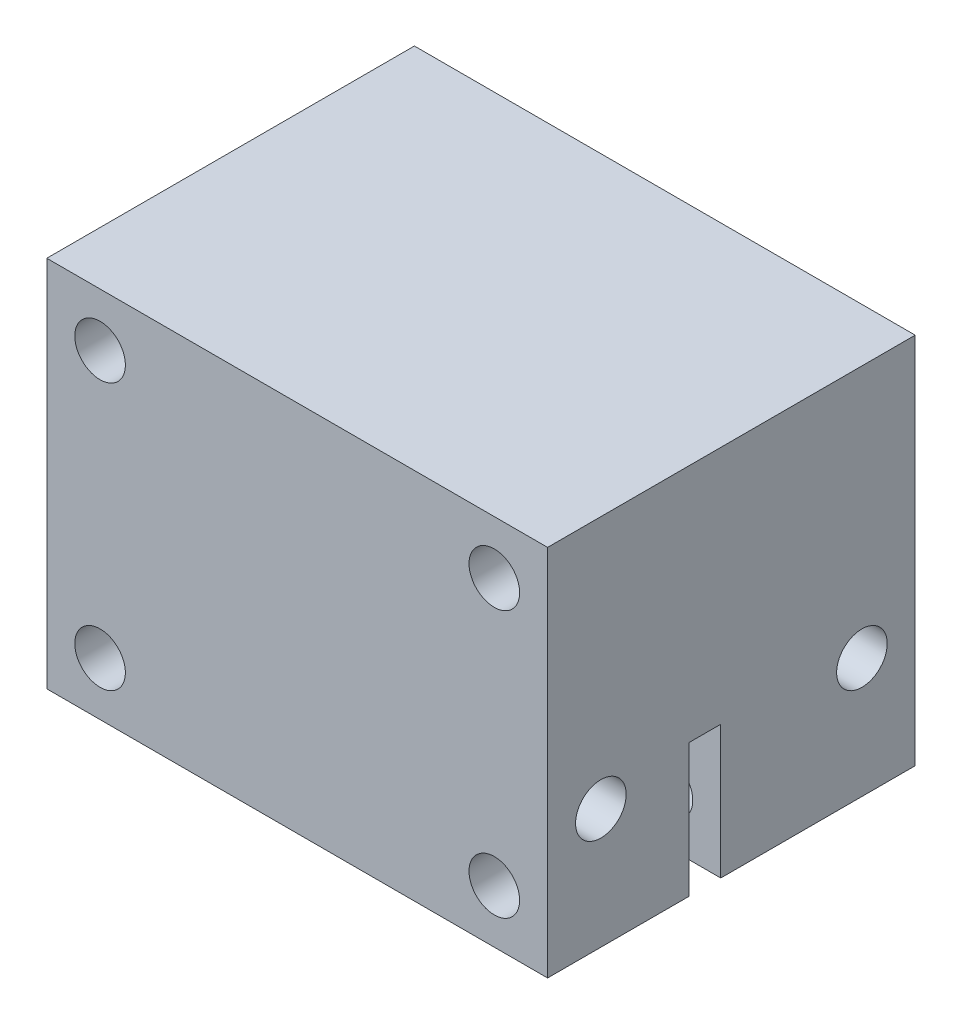
from build123d import *

# Parameters (mm, degrees)
SKETCH_1_W          = 37.6
SKETCH_1_H          = 28
SKETCH_1_R          = 1.9
EXTRUDE_1_DEPTH     = 27.6
SKETCH_2_R          = 1.9
SKETCH_2_W          = 2.4
SKETCH_2_H          = 10
CUT_EXTRUDE_1_DEPTH = 55.401470568


with BuildPart() as part:
    # 草图1 → 凸台-拉伸1 (new body)
    with BuildSketch(Plane.XY):
        with Locations((18.8, 14)):
            Rectangle(SKETCH_1_W, SKETCH_1_H)
        with Locations(Location((4, 24, 0), (0, 0, 180))):
            Circle(SKETCH_1_R, mode=Mode.SUBTRACT)
        with Locations(Location((33.6, 24, 0), (0, 0, 180))):
            Circle(SKETCH_1_R, mode=Mode.SUBTRACT)
        with Locations(Location((33.6, 4, 0), (0, 0, 180))):
            Circle(SKETCH_1_R, mode=Mode.SUBTRACT)
        with Locations(Location((4, 4, 0), (0, 0, 180))):
            Circle(SKETCH_1_R, mode=Mode.SUBTRACT)
    extrude(amount=EXTRUDE_1_DEPTH)

    # 草图2 → 切除-拉伸1 (cut, through all)
    with BuildSketch(Plane(origin=(37.6, 0, 0), x_dir=(0, 0, -1), z_dir=(1, 0, 0))):
        with Locations(Location((-23.6, 9, 0), (0, 0, 90))):
            Circle(SKETCH_2_R)
        with Locations(Location((-4, 9, 0), (0, 0, 90))):
            Circle(SKETCH_2_R)
        with Locations((-15.8, 5)):
            Rectangle(SKETCH_2_W, SKETCH_2_H)
    extrude(amount=-CUT_EXTRUDE_1_DEPTH, mode=Mode.SUBTRACT)


solid = part.part
